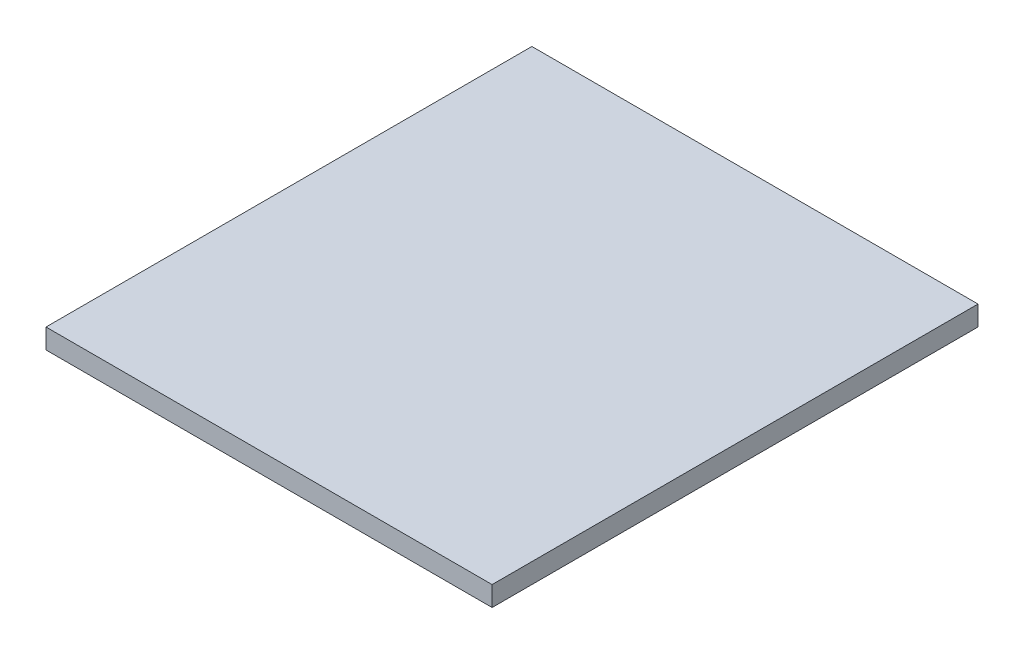
from build123d import *

# Parameters (mm, degrees)
SKETCH1_W           = 284.8
SKETCH1_H           = 12.7
BOSS_EXTRUDE1_DEPTH = 310.2


with BuildPart() as part:
    # Sketch1 → Boss-Extrude1 (new body)
    with BuildSketch(Plane.XY):
        with Locations((147.4, -6.15)):
            Rectangle(SKETCH1_W, SKETCH1_H)
    extrude(amount=BOSS_EXTRUDE1_DEPTH)


solid = part.part
